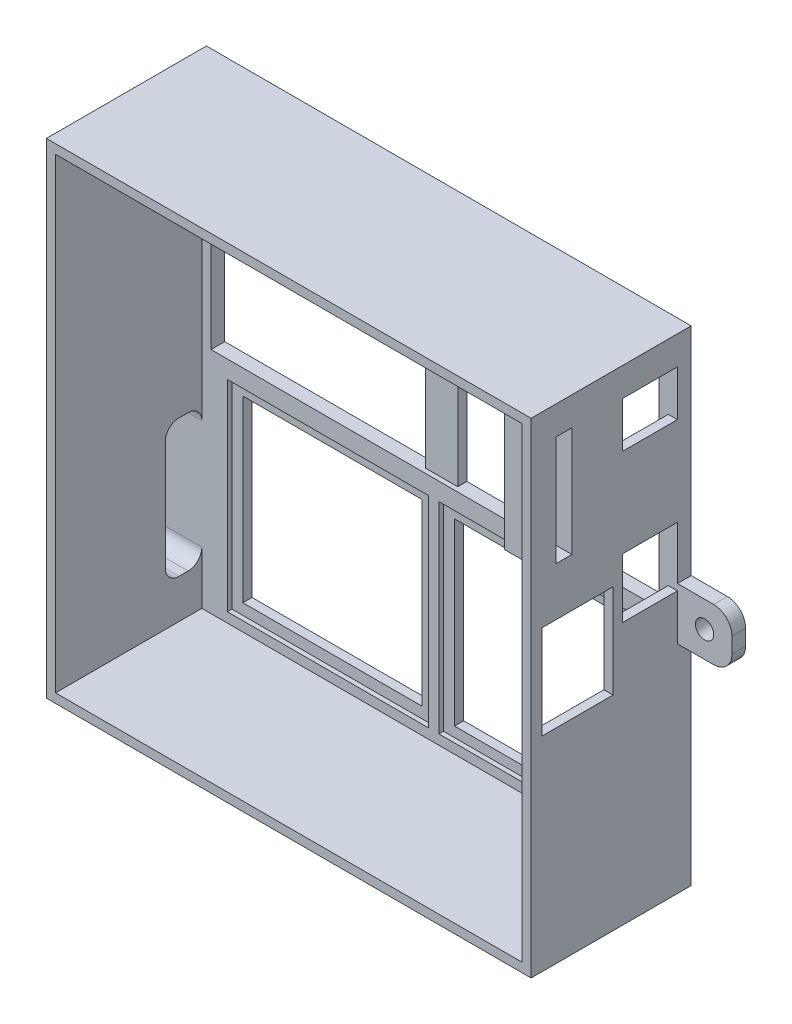
from build123d import *

# Parameters (mm, degrees)
SKETCH_1_W           = 102
SKETCH_1_H           = 54
SKETCH_1_W_2         = 44
SKETCH_1_H_2         = 44
EXTRUDE_1_DEPTH      = 5
SKETCH_2_W           = 102
SKETCH_2_H           = 54
SKETCH_2_W_2         = 98
SKETCH_2_H_2         = 49.988098762
SKETCH_2_W_3         = 44
SKETCH_2_H_3         = 44
SKETCH_2_W_4         = 39.827305616
SKETCH_2_H_4         = 40.011901238
EXTRUDE_2_DEPTH      = 3
SKETCH_3_W           = 106
SKETCH_3_H           = 106
SKETCH_3_W_2         = 102
SKETCH_3_H_2         = 102
EXTRUDE_3_DEPTH      = 30
SKETCH_4_W           = 12
SKETCH_4_H           = 10
SKETCH_4_H_2         = 13
CUT_EXTRUDE_1_DEPTH  = 30
SKETCH_5_W           = 44
SKETCH_5_H           = 44
CUT_EXTRUDE_2_DEPTH  = 3
SKETCH_6_W           = 39.675099194
SKETCH_6_H           = 39.248485224
CUT_EXTRUDE_3_DEPTH  = 87.290021993
SKETCH_8_W           = 39.827305616
SKETCH_8_H           = 40.011901238
SKETCH_8_W_2         = 7.107215528
SKETCH_8_H_2         = 49.988098762
EXTRUDE_5_DEPTH      = 2
EXTRUDE_6_DEPTH      = 2
EXTRUDE_6_DEPTH_BACK = 3
SKETCH_9_W           = 44
SKETCH_9_H           = 44
SKETCH_10_W          = 44
SKETCH_10_H          = 44
CUT_EXTRUDE_5_DEPTH  = 3
SKETCH_11_W          = 39.141831732
SKETCH_11_H          = 39.141831732
CUT_EXTRUDE_6_DEPTH  = 3
SKETCH_12_W          = 10
SKETCH_12_H          = 30
EXTRUDE_7_DEPTH      = 10
SKETCH_13_W          = 3.5
SKETCH_13_H          = 24
CUT_EXTRUDE_7_DEPTH  = 20
CUT_EXTRUDE_8_DEPTH  = 29.999730027
SKETCH_15_W          = 15.5
SKETCH_15_H          = 20.5
CUT_EXTRUDE_9_DEPTH  = 30
SKETCH_18_W          = 102
SKETCH_18_H          = 48
CUT_EXTRUDE_11_DEPTH = 2
CUT_EXTRUDE_12_DEPTH = 124.099226215
EXTRUDE_10_DEPTH     = 6
SKETCH_21_R          = 2
EXTRUDE_11_DEPTH     = 3


with BuildPart() as part:
    # 草图1 → 凸台-拉伸1 (new body)
    with BuildSketch(Plane.XY):
        Polygon((-56.9609375, 55.7890625), (49.0390625, 55.7890625), (49.0390625, -2.2109375), (49.0390625, -50.2109375), (-8.9609375, -50.2109375), (-56.9609375, -50.2109375), (-56.9609375, -2.2109375), align=None)
        with Locations((-3.9609375, 26.7890625)):
            Rectangle(SKETCH_1_W, SKETCH_1_H, mode=Mode.SUBTRACT)
        with Locations((-32.9609375, -26.2109375)):
            Rectangle(SKETCH_1_W_2, SKETCH_1_H_2, mode=Mode.SUBTRACT)
    extrude(amount=EXTRUDE_1_DEPTH)

    # 草图2 → 凸台-拉伸2 (add)
    # profile 1 of 2: a face of its own
    with BuildSketch(Plane(origin=(0, 0, 0), x_dir=(-1, 0, 0), z_dir=(0, 0, -1))):
        with Locations((3.9609375, 26.7890625)):
            Rectangle(SKETCH_2_W, SKETCH_2_H)
        with Locations((3.9609375, 26.795013119)):
            Rectangle(SKETCH_2_W_2, SKETCH_2_H_2, mode=Mode.SUBTRACT)
    # profile 2 of 2: a face of its own
    with BuildSketch(Plane(origin=(0, 0, 0), x_dir=(-1, 0, 0), z_dir=(0, 0, -1))):
        with Locations((32.9609375, -26.2109375)):
            Rectangle(SKETCH_2_W_3, SKETCH_2_H_3)
        with Locations((33.047284692, -26.204986881)):
            Rectangle(SKETCH_2_W_4, SKETCH_2_H_4, mode=Mode.SUBTRACT)
    extrude(amount=-EXTRUDE_2_DEPTH)

    # 草图3 → 凸台-拉伸3 (add)
    with BuildSketch(Plane.XY.offset(5)):
        with Locations((-3.9609375, 2.7890625)):
            Rectangle(SKETCH_3_W, SKETCH_3_H)
        with Locations((-3.9609375, 2.7890625)):
            Rectangle(SKETCH_3_W_2, SKETCH_3_H_2, mode=Mode.SUBTRACT)
    extrude(amount=EXTRUDE_3_DEPTH)

    # 草图4 → 切除-拉伸1 (cut)
    with BuildSketch(Plane(origin=(49.0390625, 0, 0), x_dir=(0, 0, -1), z_dir=(1, 0, 0))):
        with Locations((-9, 44.531190652)):
            Rectangle(SKETCH_4_W, SKETCH_4_H)
        with Locations((-9, 13.608528945)):
            Rectangle(SKETCH_4_W, SKETCH_4_H_2)
    extrude(amount=-CUT_EXTRUDE_1_DEPTH, mode=Mode.SUBTRACT)

    # 草图5 → 切除-拉伸2 (cut)
    with BuildSketch(Plane.XY.offset(5)):
        with Locations((18.871191973, -24.065672965)):
            Rectangle(SKETCH_5_W, SKETCH_5_H)
    extrude(amount=-CUT_EXTRUDE_2_DEPTH, mode=Mode.SUBTRACT)

    # 草图6 → 切除-拉伸3 (cut, through all)
    with BuildSketch(Plane.XY.offset(2)):
        with Locations((19.129543617, -24.247597838)):
            Rectangle(SKETCH_6_W, SKETCH_6_H)
    extrude(amount=-CUT_EXTRUDE_3_DEPTH, mode=Mode.SUBTRACT)

    # 草图8 → 凸台-拉伸5 (add)
    with BuildSketch(Plane(origin=(0, 0, 0), x_dir=(-1, 0, 0), z_dir=(0, 0, -1))):
        with Locations((33.047284692, -26.204986881)):
            Rectangle(SKETCH_8_W, SKETCH_8_H)
        with Locations((3.553607764, 26.795013119)):
            Rectangle(SKETCH_8_W_2, SKETCH_8_H_2)
    extrude(amount=-EXTRUDE_5_DEPTH)

    # 草图9 → 凸台-拉伸6 (add, two sides: drawn at the far end of the back side and taken through both)
    with BuildSketch(Plane.XY.offset(3).offset(-EXTRUDE_6_DEPTH_BACK)):
        with Locations((-32.9609375, -26.2109375)):
            Rectangle(SKETCH_9_W, SKETCH_9_H)
    extrude(amount=EXTRUDE_6_DEPTH + EXTRUDE_6_DEPTH_BACK)

    # 草图10 → 切除-拉伸5 (cut)
    with BuildSketch(Plane.XY.offset(5)):
        with Locations((-27.400759648, -24.065672965)):
            Rectangle(SKETCH_10_W, SKETCH_10_H)
    extrude(amount=-CUT_EXTRUDE_5_DEPTH, mode=Mode.SUBTRACT)

    # 草图11 → 切除-拉伸6 (cut)
    with BuildSketch(Plane.XY.offset(2)):
        with Locations((-27.424705841, -24.087617599)):
            Rectangle(SKETCH_11_W, SKETCH_11_H)
    extrude(amount=-CUT_EXTRUDE_6_DEPTH, mode=Mode.SUBTRACT)

    # 草图12 → 凸台-拉伸7 (add)
    with BuildSketch(Plane(origin=(49.0390625, 0, 0), x_dir=(0, 0, -1), z_dir=(1, 0, 0))):
        with Locations((-25.778359811, 38.789332473)):
            Rectangle(SKETCH_12_W, SKETCH_12_H)
    extrude(amount=-EXTRUDE_7_DEPTH)

    # 草图13 → 切除-拉伸7 (cut)
    with BuildSketch(Plane(origin=(49.0390625, 0, 0), x_dir=(0, 0, -1), z_dir=(1, 0, 0))):
        with Locations((-27.833078142, 37.536383555)):
            Rectangle(SKETCH_13_W, SKETCH_13_H)
    extrude(amount=-CUT_EXTRUDE_7_DEPTH, mode=Mode.SUBTRACT)

    # 草图14 → 切除-拉伸8 (cut)
    with BuildSketch(Plane.XZ.offset(-23.789332473)):
        Polygon((37.906859467, 25.472396685), (38.543242323, 25.472396685), (47.0390625, 20.778359811), (47.0390625, 19.400243598), (37.906859467, 19.400243598), align=None)
    extrude(amount=-CUT_EXTRUDE_8_DEPTH, mode=Mode.SUBTRACT)

    # 草图15 → 切除-拉伸9 (cut)
    with BuildSketch(Plane(origin=(49.0390625, 0, 0), x_dir=(0, 0, -1), z_dir=(1, 0, 0))):
        with Locations((-24.841469183, 4.666763342)):
            Rectangle(SKETCH_15_W, SKETCH_15_H)
    extrude(amount=-CUT_EXTRUDE_9_DEPTH, mode=Mode.SUBTRACT)

    # 草图18 → 切除-拉伸11 (cut)
    with BuildSketch(Plane.XY.offset(5)):
        with Locations((-3.9609375, -24.2109375)):
            Rectangle(SKETCH_18_W, SKETCH_18_H)
    extrude(amount=-CUT_EXTRUDE_11_DEPTH, mode=Mode.SUBTRACT)

    # 草图19 → 切除-拉伸12 (cut, through all)
    with BuildSketch(Plane(origin=(-54.9609375, 0, 0), x_dir=(0, 0, -1), z_dir=(1, 0, 0))):
        with BuildLine():
            Line((-8, -9.636069371), (-6, -9.636069371))
            ThreePointArc((-6, -9.636069371), (-3.878679656, -10.514749028), (-3, -12.636069371))
            Line((-3, -12.636069371), (-3, -36.636069371))
            ThreePointArc((-3, -36.636069371), (-3.878679656, -38.757389715), (-6, -39.636069371))
            Line((-6, -39.636069371), (-8, -39.636069371))
            ThreePointArc((-8, -39.636069371), (-10.121320344, -38.757389715), (-11, -36.636069371))
            Line((-11, -36.636069371), (-11, -12.636069371))
            ThreePointArc((-11, -12.636069371), (-10.121320344, -10.514749028), (-8, -9.636069371))
        make_face()
    extrude(amount=-CUT_EXTRUDE_12_DEPTH, mode=Mode.SUBTRACT)

    # 草图20 → 凸台-拉伸10 (add)
    with BuildSketch(Plane.ZY.offset(56.9609375)):
        with BuildLine():
            Line((3, -36.636069371), (3, -41.845424094))
            Line((3, -41.845424094), (9.180533555, -41.845424094))
            ThreePointArc((9.180533555, -41.845424094), (12.00896068, -40.673851218), (13.180533555, -37.845424094))
            Line((13.180533555, -37.845424094), (13.180533555, -11.076385552))
            ThreePointArc((13.180533555, -11.076385552), (12.00896068, -8.247958428), (9.180533555, -7.076385552))
            Line((9.180533555, -7.076385552), (3, -7.076385552))
            Line((3, -7.076385552), (3, -12.636069371))
            ThreePointArc((3, -12.636069371), (3.878679656, -10.514749028), (6, -9.636069371))
            Line((6, -9.636069371), (8, -9.636069371))
            ThreePointArc((8, -9.636069371), (10.121320344, -10.514749028), (11, -12.636069371))
            Line((11, -12.636069371), (11, -36.636069371))
            ThreePointArc((11, -36.636069371), (10.121320344, -38.757389715), (8, -39.636069371))
            Line((8, -39.636069371), (6, -39.636069371))
            ThreePointArc((6, -39.636069371), (3.878679656, -38.757389715), (3, -36.636069371))
        make_face()
        Polygon((0, -7.076385552), (0, -41.845424094), (3, -41.845424094), (3, -36.636069371), (3, -12.636069371), (3, -7.076385552), align=None)
    extrude(amount=EXTRUDE_10_DEPTH)

    # 草图21 → 凸台-拉伸11 (add)
    # profile 1 of 2: a face of its own
    with BuildSketch(Plane(origin=(0, 0, 0), x_dir=(-1, 0, 0), z_dir=(0, 0, -1))):
        with BuildLine():
            Line((56.9609375, -2.916899347), (64.873289872, -2.916899347))
            ThreePointArc((64.873289872, -2.916899347), (67.701716997, -1.745326471), (68.873289872, 1.083100653))
            Line((68.873289872, 1.083100653), (68.873289872, 4.495024347))
            ThreePointArc((68.873289872, 4.495024347), (67.701716997, 7.323451471), (64.873289872, 8.495024347))
            Line((64.873289872, 8.495024347), (56.9609375, 8.495024347))
            Line((56.9609375, 8.495024347), (56.9609375, -2.916899347))
        make_face()
        with Locations((62.900694294, 2.7890625)):
            Circle(SKETCH_21_R, mode=Mode.SUBTRACT)
    # profile 2 of 2: a face of its own
    with BuildSketch(Plane(origin=(0, 0, 0), x_dir=(-1, 0, 0), z_dir=(0, 0, -1))):
        with BuildLine():
            Line((-60.951414872, 1.083100653), (-60.951414872, 4.495024347))
            ThreePointArc((-60.951414872, 4.495024347), (-59.779841997, 7.323451471), (-56.951414872, 8.495024347))
            Line((-56.951414872, 8.495024347), (-49.0390625, 8.495024347))
            Line((-49.0390625, 8.495024347), (-49.0390625, -2.916899347))
            Line((-49.0390625, -2.916899347), (-56.951414872, -2.916899347))
            ThreePointArc((-56.951414872, -2.916899347), (-59.779841997, -1.745326471), (-60.951414872, 1.083100653))
        make_face()
        with Locations(Location((-54.978819294, 2.7890625, 0), (0, 0, 180))):
            Circle(SKETCH_21_R, mode=Mode.SUBTRACT)
    extrude(amount=-EXTRUDE_11_DEPTH)


solid = part.part
